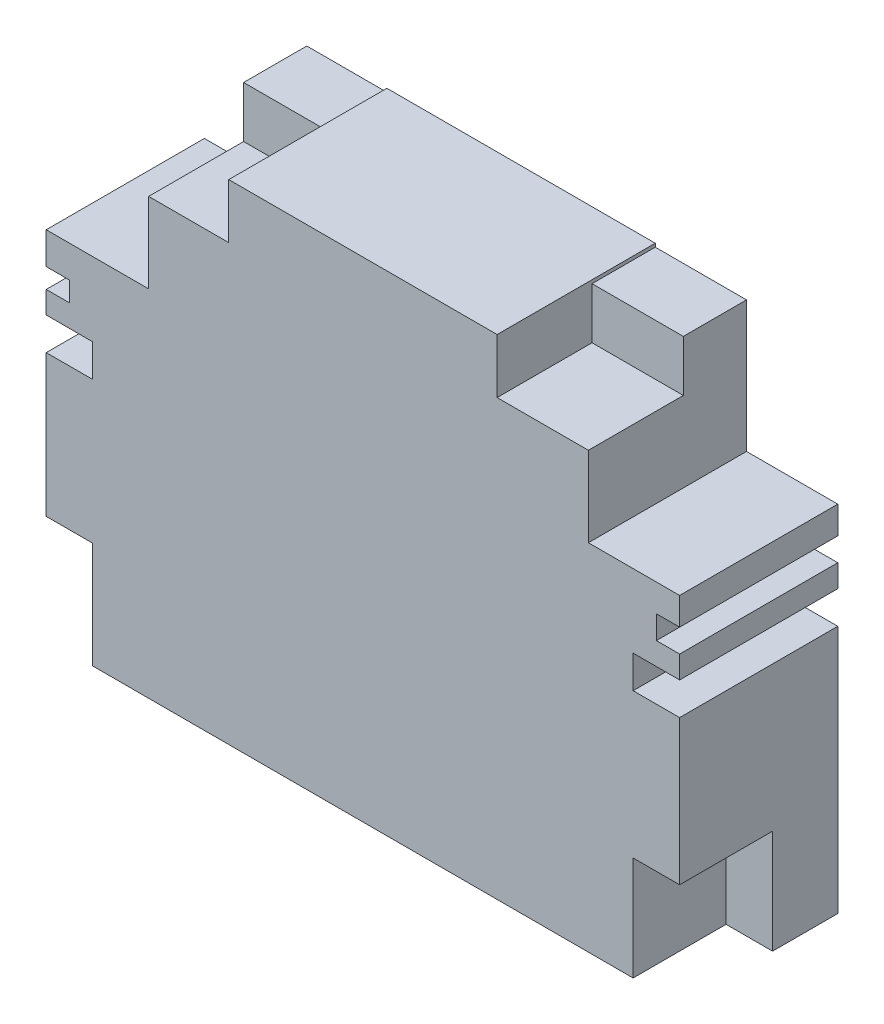
from build123d import *

# Parameters (mm, degrees)
SKETCH_1_W           = 136.18
SKETCH_1_H           = 105.19
EXTRUDE_1_DEPTH      = 34
SKETCH_3_W           = 39.24
SKETCH_3_H           = 34
CUT_EXTRUDE_1_DEPTH  = 28.96
SKETCH_4_W           = 17.22
SKETCH_4_H           = 34
EXTRUDE_2_DEPTH      = 17.22
SKETCH_5_W           = 19.62
SKETCH_5_H           = 34
EXTRUDE_3_DEPTH      = 17.22
SKETCH_6_W           = 34
SKETCH_6_H           = 4.24
CUT_EXTRUDE_2_DEPTH  = 5
SKETCH_7_W           = 34
SKETCH_7_H           = 7
CUT_EXTRUDE_4_DEPTH  = 10
SKETCH_9_W           = 19.62
SKETCH_9_H           = 13.59
EXTRUDE_4_DEPTH      = 11
SKETCH_10_W          = 17.22
SKETCH_10_H          = 13.58
EXTRUDE_5_DEPTH      = 11
SKETCH_11_W          = 34
SKETCH_11_H          = 5
CUT_EXTRUDE_7_DEPTH  = 5
SKETCH_13_W          = 33.75
SKETCH_13_H          = 7
CUT_EXTRUDE_9_DEPTH  = 10
SKETCH_15_W          = 10
SKETCH_15_H          = 7
CUT_EXTRUDE_10_DEPTH = 10
SKETCH_16_W          = 21.544160933
SKETCH_16_H          = 22.857254915
CUT_EXTRUDE_11_DEPTH = 10
SKETCH_18_W          = 19.981240116
SKETCH_18_H          = 22.352912948
CUT_EXTRUDE_12_DEPTH = 10


with BuildPart() as part:
    # 草图1 → 凸台-拉伸1 (new body)
    with BuildSketch(Plane.XY):
        with Locations((-10.139734918, 15.469024107)):
            Rectangle(SKETCH_1_W, SKETCH_1_H)
    extrude(amount=EXTRUDE_1_DEPTH)

    # 草图3 → 切除-拉伸1 (cut)
    with BuildSketch(Plane(origin=(0, 68.064024107, 0), x_dir=(1, 0, 0), z_dir=(0, 1, 0))):
        with Locations((-58.609734918, -17)):
            Rectangle(SKETCH_3_W, SKETCH_3_H)
        with Locations((38.330265082, -17)):
            Rectangle(SKETCH_3_W, SKETCH_3_H)
    extrude(amount=-CUT_EXTRUDE_1_DEPTH, mode=Mode.SUBTRACT)

    # 草图4 → 凸台-拉伸2 (add)
    with BuildSketch(Plane(origin=(0, 39.104024107, 0), x_dir=(1, 0, 0), z_dir=(0, 1, 0))):
        with Locations((-47.599734918, -17)):
            Rectangle(SKETCH_4_W, SKETCH_4_H)
    extrude(amount=EXTRUDE_2_DEPTH)

    # 草图5 → 凸台-拉伸3 (add)
    with BuildSketch(Plane(origin=(0, 39.104024107, 0), x_dir=(1, 0, 0), z_dir=(0, 1, 0))):
        with Locations((28.520265082, -17)):
            Rectangle(SKETCH_5_W, SKETCH_5_H)
    extrude(amount=EXTRUDE_3_DEPTH)

    # 草图6 → 切除-拉伸2 (cut)
    with BuildSketch(Plane.ZY.offset(78.229734918)):
        with Locations((17, 30.112750363)):
            Rectangle(SKETCH_6_W, SKETCH_6_H)
    extrude(amount=-CUT_EXTRUDE_2_DEPTH, mode=Mode.SUBTRACT)

    # 草图7 → 切除-拉伸4 (cut)
    with BuildSketch(Plane.ZY.offset(78.229734918)):
        with Locations((17, 19.728275547)):
            Rectangle(SKETCH_7_W, SKETCH_7_H)
    extrude(amount=-CUT_EXTRUDE_4_DEPTH, mode=Mode.SUBTRACT)

    # 草图9 → 凸台-拉伸4 (add)
    with BuildSketch(Plane(origin=(0, 56.324024107, 0), x_dir=(1, 0, 0), z_dir=(0, 1, 0))):
        with Locations((28.520265082, -6.795)):
            Rectangle(SKETCH_9_W, SKETCH_9_H)
    extrude(amount=EXTRUDE_4_DEPTH)

    # 草图10 → 凸台-拉伸5 (add)
    with BuildSketch(Plane(origin=(0, 56.324024107, 0), x_dir=(1, 0, 0), z_dir=(0, 1, 0))):
        with Locations((-47.599734918, -6.79)):
            Rectangle(SKETCH_10_W, SKETCH_10_H)
    extrude(amount=EXTRUDE_5_DEPTH)

    # 草图11 → 切除-拉伸7 (cut)
    with BuildSketch(Plane(origin=(57.950265082, 0, 0), x_dir=(0, 0, -1), z_dir=(1, 0, 0))):
        with Locations((-17, 30.695910163)):
            Rectangle(SKETCH_11_W, SKETCH_11_H)
    extrude(amount=-CUT_EXTRUDE_7_DEPTH, mode=Mode.SUBTRACT)

    # 草图13 → 切除-拉伸9 (cut)
    with BuildSketch(Plane(origin=(57.950265082, 0, 0), x_dir=(0, 0, -1), z_dir=(1, 0, 0))):
        with Locations((-16.874526915, 19.863616172)):
            Rectangle(SKETCH_13_W, SKETCH_13_H)
    extrude(amount=-CUT_EXTRUDE_9_DEPTH, mode=Mode.SUBTRACT)

    # 草图15 → 切除-拉伸10 (cut)
    with BuildSketch(Plane(origin=(0, 0, 33.749526915), x_dir=(-1, 0, 0), z_dir=(0, 0, -1))):
        with Locations((-52.950265082, 19.863616172)):
            Rectangle(SKETCH_15_W, SKETCH_15_H)
    extrude(amount=-CUT_EXTRUDE_10_DEPTH, mode=Mode.SUBTRACT)

    # 草图16 → 切除-拉伸11 (cut)
    with BuildSketch(Plane.ZY.offset(78.229734918)):
        with Locations((23.227919533, -25.697348436)):
            Rectangle(SKETCH_16_W, SKETCH_16_H)
    extrude(amount=-CUT_EXTRUDE_11_DEPTH, mode=Mode.SUBTRACT)

    # 草图18 → 切除-拉伸12 (cut)
    with BuildSketch(Plane(origin=(57.950265082, 0, 0), x_dir=(0, 0, -1), z_dir=(1, 0, 0))):
        with Locations((-24.009379942, -25.949519419)):
            Rectangle(SKETCH_18_W, SKETCH_18_H)
    extrude(amount=-CUT_EXTRUDE_12_DEPTH, mode=Mode.SUBTRACT)


solid = part.part
